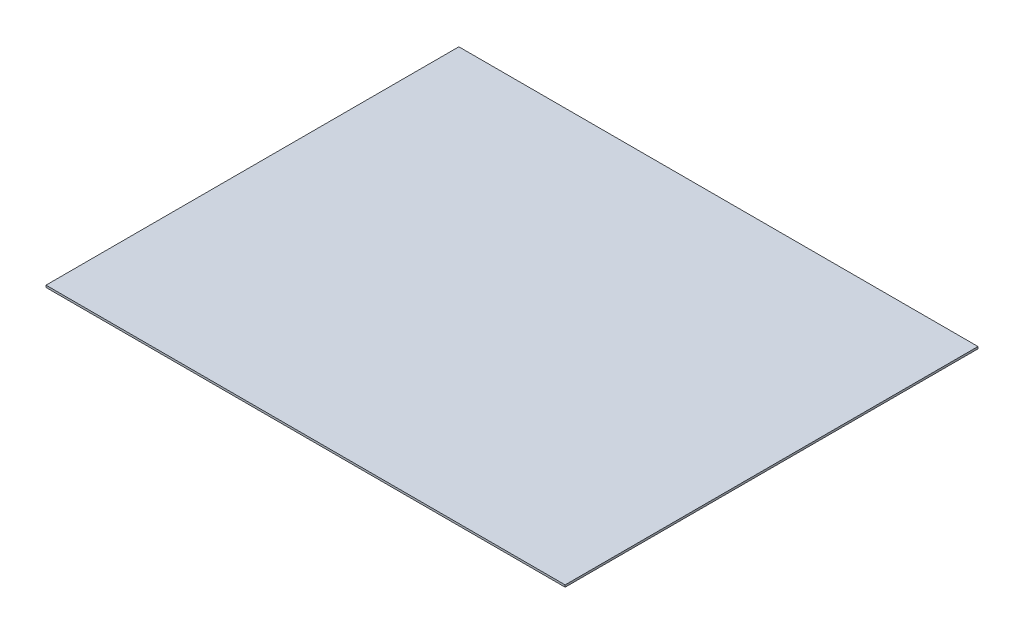
from build123d import *

# Parameters (mm, degrees)
SKETCH1_W           = 645.16
SKETCH1_H           = 513.08
BOSS_EXTRUDE1_DEPTH = 2.54


with BuildPart() as part:
    # Sketch1 → Boss-Extrude1 (new body)
    with BuildSketch(Plane(origin=(0, 0, 0), x_dir=(1, 0, 0), z_dir=(0, 1, 0))):
        with Locations((322.58, 256.54)):
            Rectangle(SKETCH1_W, SKETCH1_H)
    extrude(amount=BOSS_EXTRUDE1_DEPTH)


solid = part.part
